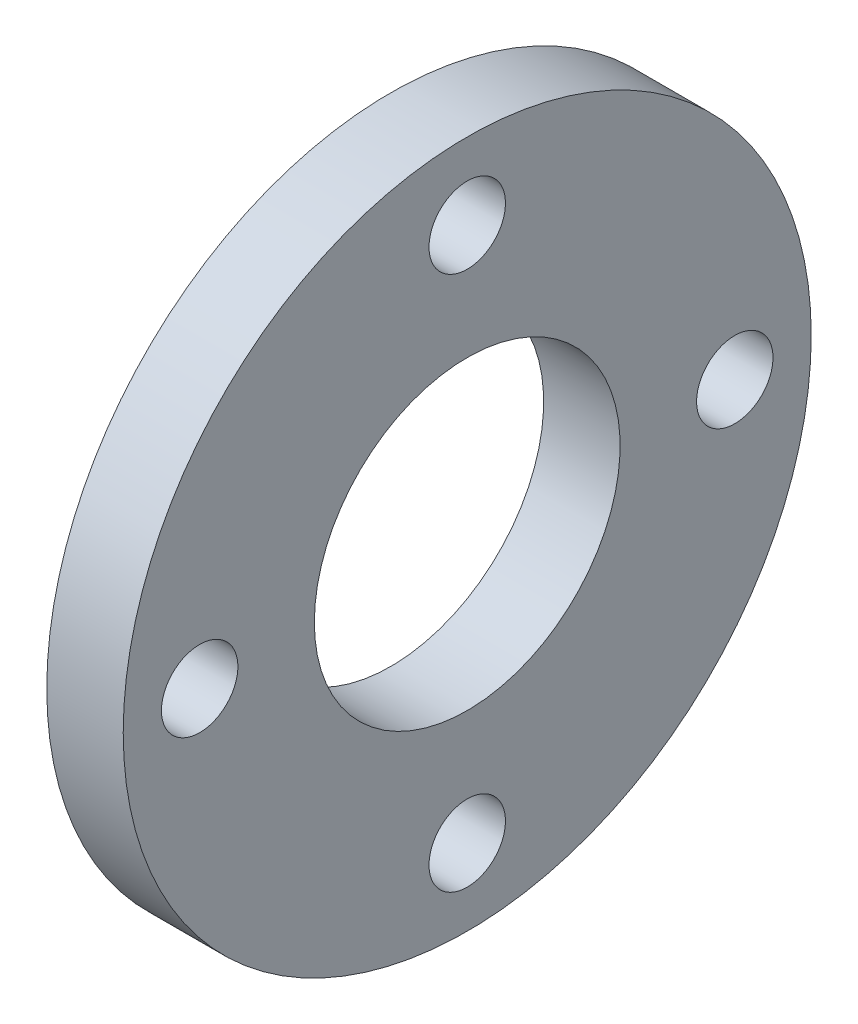
from build123d import *

# Parameters (mm, degrees)
SKETCH1_R           = 28.575
SKETCH1_R_2         = 12.7
SKETCH1_R_3         = 3.175
BOSS_EXTRUDE1_DEPTH = 6.35


with BuildPart() as part:
    # Sketch1 → Boss-Extrude1 (new body)
    with BuildSketch(Plane.ZY.offset(-33.3375)):
        with Locations((-3.206573009, 186.931527045)):
            Circle(SKETCH1_R)
        with Locations((-3.206573009, 186.931527045)):
            Circle(SKETCH1_R_2, mode=Mode.SUBTRACT)
        with Locations((19.018426991, 186.931527045)):
            Circle(SKETCH1_R_3, mode=Mode.SUBTRACT)
        with Locations((-3.206573009, 164.706527045)):
            Circle(SKETCH1_R_3, mode=Mode.SUBTRACT)
        with Locations((-25.431573009, 186.931527045)):
            Circle(SKETCH1_R_3, mode=Mode.SUBTRACT)
        with Locations((-3.206573009, 209.156527045)):
            Circle(SKETCH1_R_3, mode=Mode.SUBTRACT)
    extrude(amount=BOSS_EXTRUDE1_DEPTH)


solid = part.part
